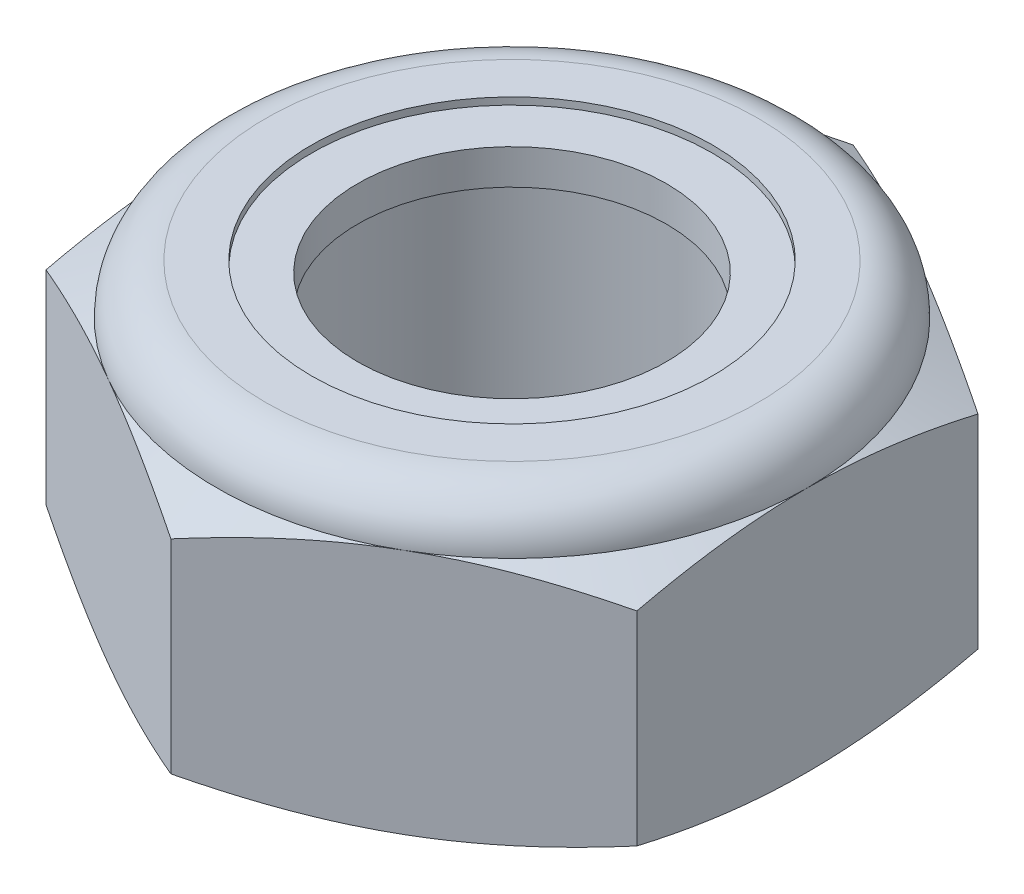
from build123d import *

# Parameters (mm, degrees)
EXTRUDE1_DEPTH = 6.35
SKETCH2_W      = 3.9624
SKETCH2_H      = 6.35


with BuildPart() as part:
    # Sketch1 → Extrude1 (new body)
    with BuildSketch(Plane(origin=(0, 0, 0), x_dir=(1, 0, 0), z_dir=(0, 1, 0))):
        Polygon((0, 7.332348419), (-6.35, 3.666174209), (-6.35, -3.666174209), (0, -7.332348419), (6.35, -3.666174209), (6.35, 3.666174209), align=None)
    extrude(amount=EXTRUDE1_DEPTH)


with BuildPart() as body_2:
    # Sketch2 → Revolve1 (revolve)
    with BuildSketch(Plane(origin=(0, 0, 0), x_dir=(0, 0, -1), z_dir=(1, 0, 0))):
        with Locations((1.9812, 3.175)):
            Rectangle(SKETCH2_W, SKETCH2_H)
    revolve(axis=Axis((0, -3.9624, 0), (0, 1, 0)))


with BuildPart() as part_1:
    add(part.part)

    # Combine1: cut body 2
    add(body_2.part, mode=Mode.SUBTRACT)

    # Sketch5 → Cut-Revolve3 (revolve, cut)
    with BuildSketch(Plane(origin=(0, 0, 0), x_dir=(0, 0, -1), z_dir=(1, 0, 0))):
        with BuildLine():
            Line((0, 0), (6.35, 0))
            Line((6.35, 0), (7.332348419, 0.458076591))
            Line((7.332348419, 0.458076591), (7.332348419, 4.833590076))
            Line((7.332348419, 4.833590076), (6.35, 5.291666667))
            ThreePointArc((6.35, 5.291666667), (6.040021343, 6.040021343), (5.291666667, 6.35))
            Line((5.291666667, 6.35), (5.291666667, 7.62))
            Line((5.291666667, 7.62), (8.602348419, 7.62))
            Line((8.602348419, 7.62), (8.602348419, -1.27))
            Line((8.602348419, -1.27), (0, -1.27))
            Line((0, -1.27), (0, 0))
        make_face()
    revolve(axis=Axis((0, 0, 0), (0, 1, 0)), mode=Mode.SUBTRACT)

    # Sketch6 → Cut-Revolve4 (revolve, cut)
    with BuildSketch(Plane(origin=(0, 0, 0), x_dir=(0, 0, -1), z_dir=(1, 0, 0))):
        with BuildLine():
            Line((0, 5.291666667), (6.1976, 5.291666667))
            ThreePointArc((6.1976, 5.291666667), (5.93225827, 5.93225827), (5.291666667, 6.1976))
            Line((5.291666667, 6.1976), (4.305167447, 6.1976))
            Line((4.305167447, 6.1976), (4.305167447, 7.62))
            Line((4.305167447, 7.62), (0, 7.62))
            Line((0, 7.62), (0, 5.291666667))
        make_face()
    revolve(axis=Axis((0, 7.62, 0), (0, 1, 0)), mode=Mode.SUBTRACT)


with BuildPart() as body_2_2:
    # Sketch7 → Revolve2 (revolve)
    with BuildSketch(Plane(origin=(0, 0, 0), x_dir=(0, 0, -1), z_dir=(1, 0, 0))):
        with BuildLine():
            Line((3.318668226, 5.367866667), (6.117893612, 5.367866667))
            ThreePointArc((6.117893612, 5.367866667), (5.850787282, 5.904725834), (5.291666667, 6.1214))
            Line((5.291666667, 6.1214), (3.318668226, 6.1214))
            Line((3.318668226, 6.1214), (3.318668226, 5.367866667))
        make_face()
    revolve(axis=Axis((0, 5.367866667, 0), (0, 1, 0)))


solid = Compound([part_1.part, body_2_2.part])
